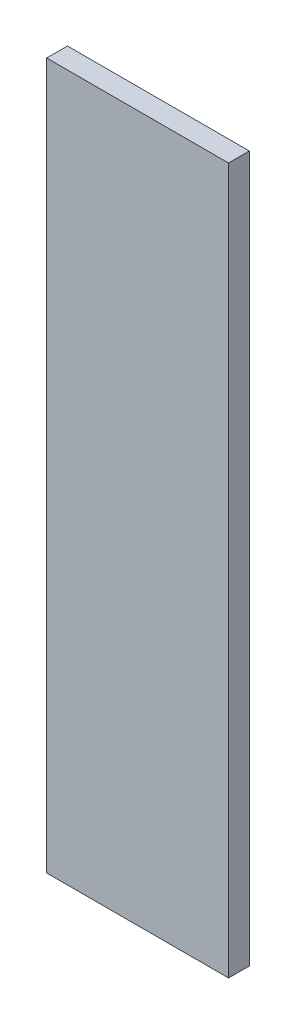
from build123d import *

# Parameters (mm, degrees)
SKETCH1_W           = 166.6875
SKETCH1_H           = 646.938
BOSS_EXTRUDE1_DEPTH = 19.05


with BuildPart() as part:
    # Sketch1 → Boss-Extrude1 (new body)
    with BuildSketch(Plane.XY):
        with Locations((67.335084573, -294.238362757)):
            Rectangle(SKETCH1_W, SKETCH1_H)
    extrude(amount=BOSS_EXTRUDE1_DEPTH)


solid = part.part
